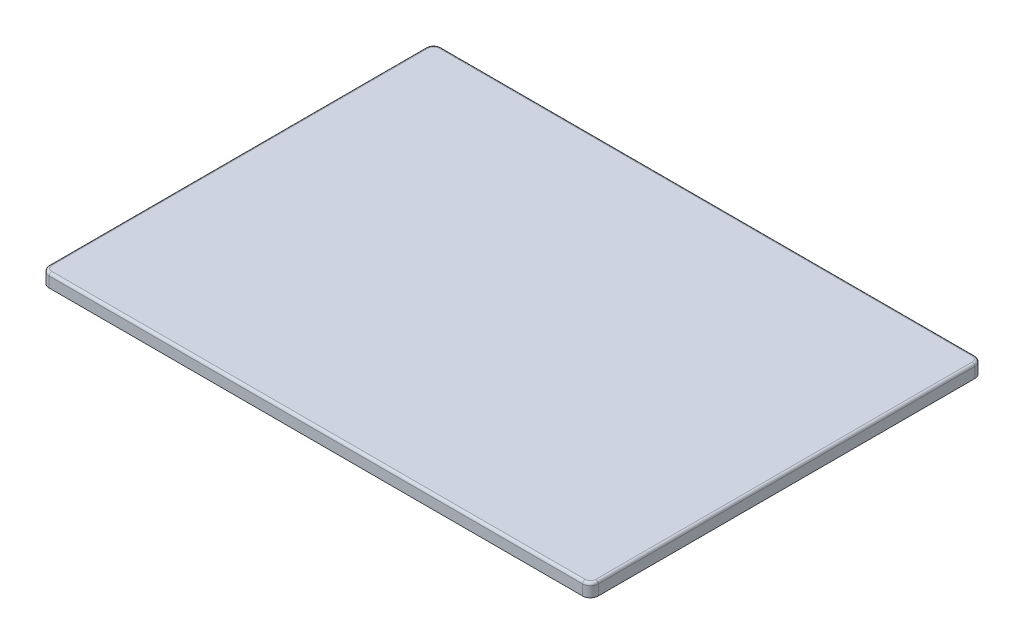
from build123d import *

# Parameters (mm, degrees)
BOSS_EXTRUDE1_DEPTH = 5
FILLET1_R           = 1


with BuildPart() as part:
    # Sketch1 → Boss-Extrude1 (new body)
    with BuildSketch(Plane(origin=(0, 0, 0), x_dir=(-1, 0, 0), z_dir=(0, 1, 0))):
        with BuildLine():
            Line((-2, 5), (202, 5))
            ThreePointArc((202, 5), (204.121320344, 4.121320344), (205, 2))
            Line((205, 2), (205, -142))
            ThreePointArc((205, -142), (204.121320344, -144.121320344), (202, -145))
            Line((202, -145), (-2, -145))
            ThreePointArc((-2, -145), (-4.121320344, -144.121320344), (-5, -142))
            Line((-5, -142), (-5, 2))
            ThreePointArc((-5, 2), (-4.121320344, 4.121320344), (-2, 5))
        make_face()
    extrude(amount=BOSS_EXTRUDE1_DEPTH)

    # Fillet1
    fillet1_edges = [part.edges().sort_by_distance(p)[0] for p in [
        (-204.121320344, 5, -144.121320344),
        (-205, 5, -70),
        (-204.121320344, 5, 4.121320344),
        (-100, 5, 5),
        (4.121320344, 5, 4.121320344),
        (5, 5, -70),
        (4.121320344, 5, -144.121320344),
        (-100, 5, -145),
    ]]
    fillet(fillet1_edges, radius=FILLET1_R)


solid = part.part
